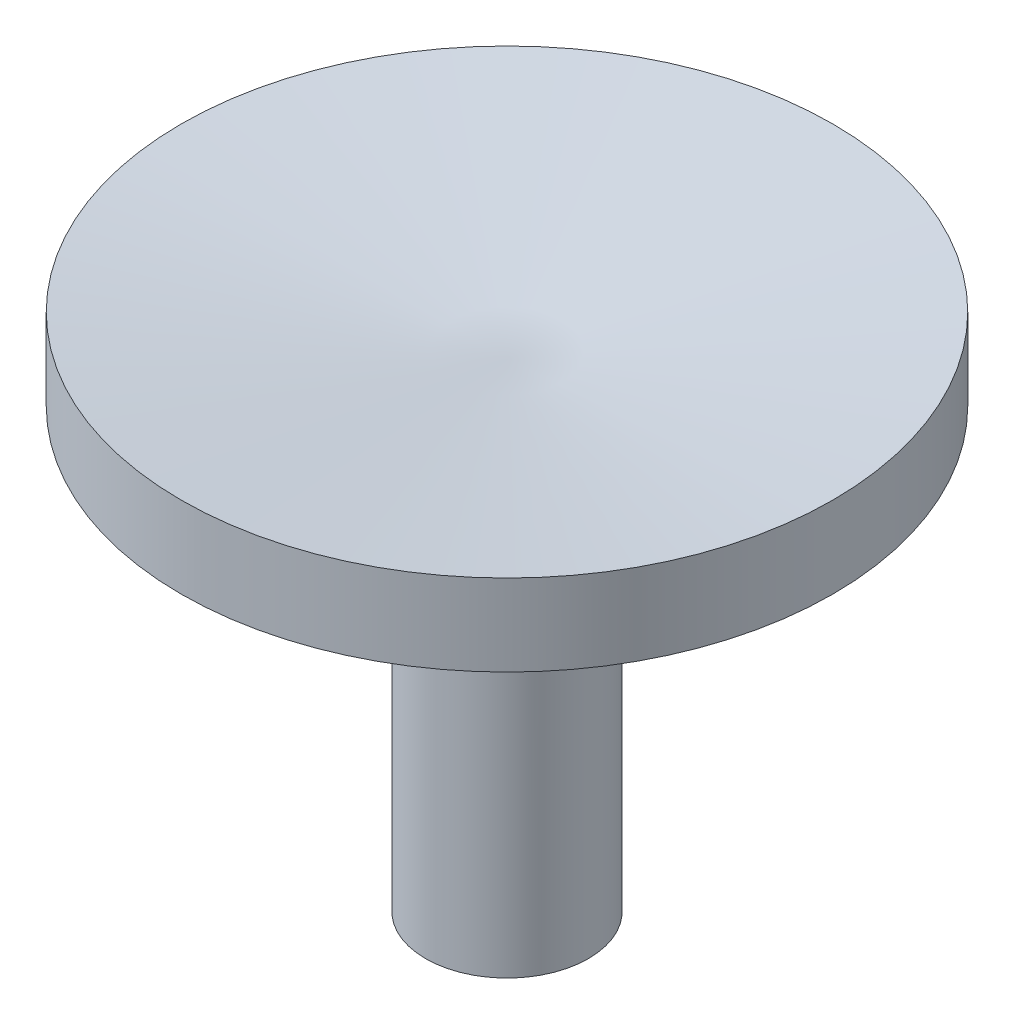
from build123d import *

# Parameters (mm, degrees)
SKETCH3_R           = 1
BOSS_EXTRUDE1_DEPTH = 5


with BuildPart() as part:
    # Sketch2 → Revolve1 (revolve)
    with BuildSketch(Plane.XY, mode=Mode.PRIVATE) as revolve1_sk:
        Polygon((0, 0), (0, 0.875), (4, 1.375), (4, 0.375), (1, 0), align=None)
    revolve(revolve1_sk.sketch.rotate(Axis((0, 0, 0), (0, 1, 0)), 270), axis=Axis((0, 0, 0), (0, 1, 0)))

    # Sketch3 → Boss-Extrude1 (add)
    with BuildSketch(Plane.XZ):
        with Locations(Location((0, 0, 0), (0, 0, 90))):
            Circle(SKETCH3_R)
    extrude(amount=BOSS_EXTRUDE1_DEPTH)


solid = part.part
